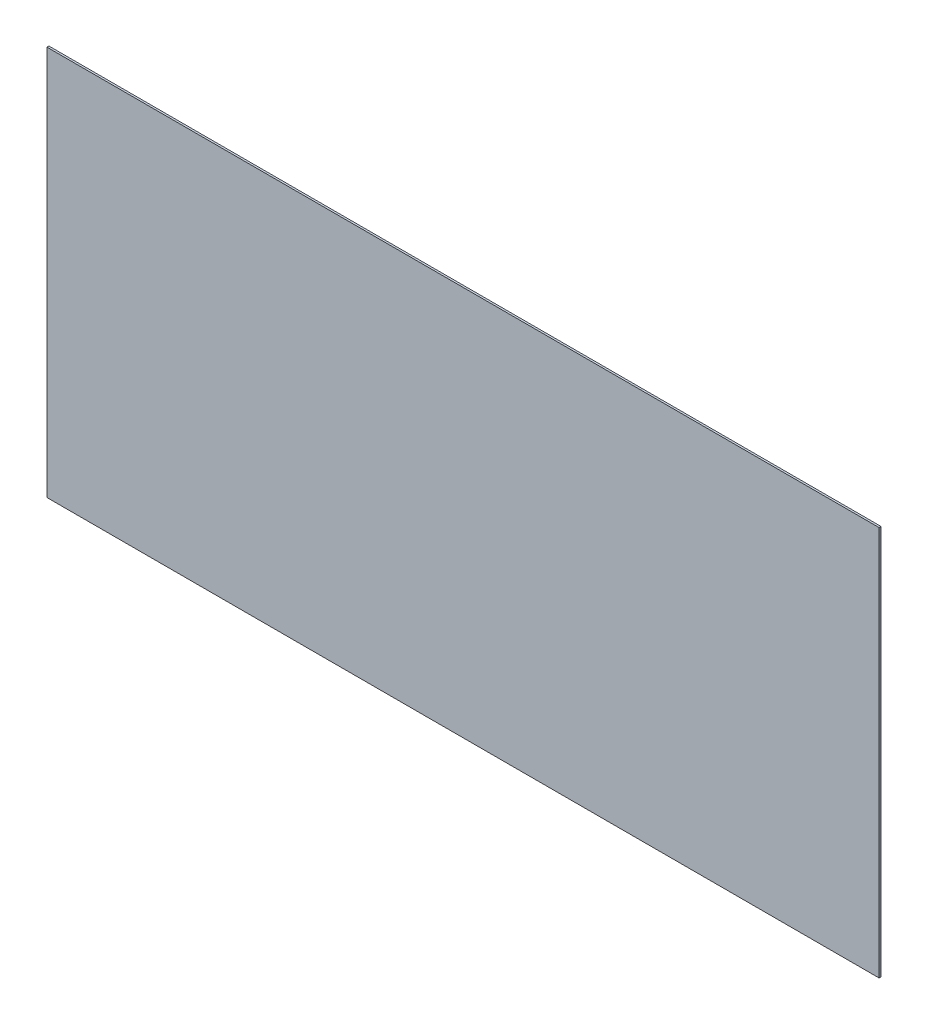
from build123d import *

# Parameters (mm, degrees)
PACK_PANEL_MEKANIZMA_1_START = 38.5
SKETCH1_W                    = 640
SKETCH1_H                    = 300
PACK_PANEL_MEKANIZMA_1_DEPTH = 1.5


with BuildPart() as part:
    # Sketch1 → PACK_panel_mekanizma_1 (new body)
    with BuildSketch(Plane.XY.offset(PACK_PANEL_MEKANIZMA_1_START)):
        with Locations((350, 450)):
            Rectangle(SKETCH1_W, SKETCH1_H)
    extrude(amount=PACK_PANEL_MEKANIZMA_1_DEPTH)


solid = part.part
